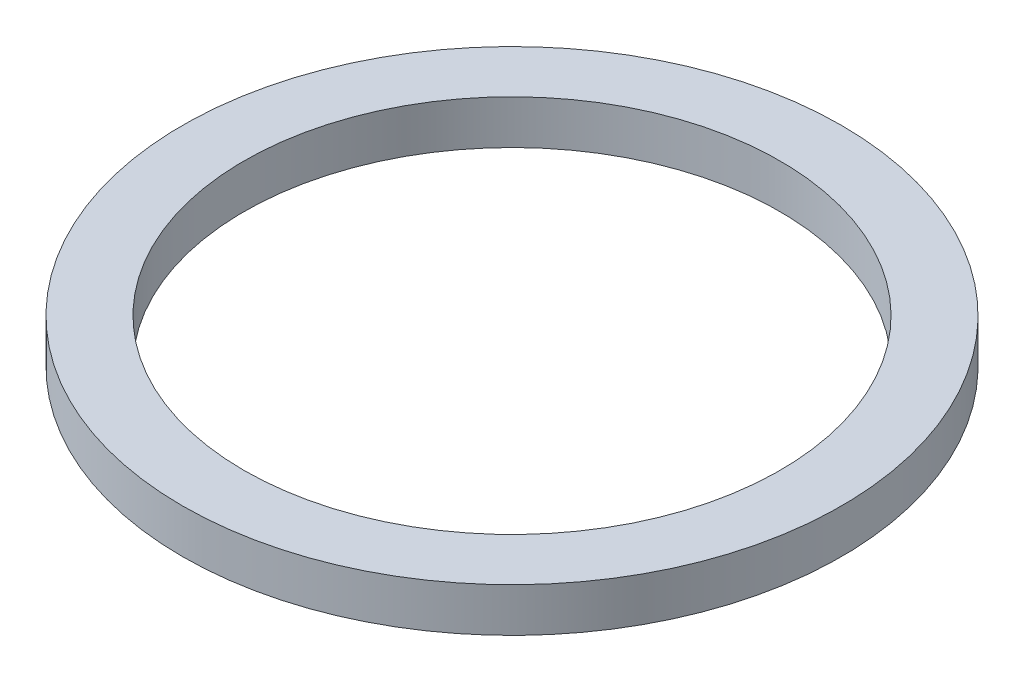
from build123d import *

# Parameters (mm, degrees)
SKETCH1_W = 1.4
SKETCH1_H = 1


with BuildPart() as part:
    # Sketch1 → Revolve1 (revolve)
    with BuildSketch(Plane.XY):
        with Locations((-6.8, 0.5)):
            Rectangle(SKETCH1_W, SKETCH1_H)
    revolve(axis=Axis((0, 0, 0), (0, -1, 0)))


solid = part.part
